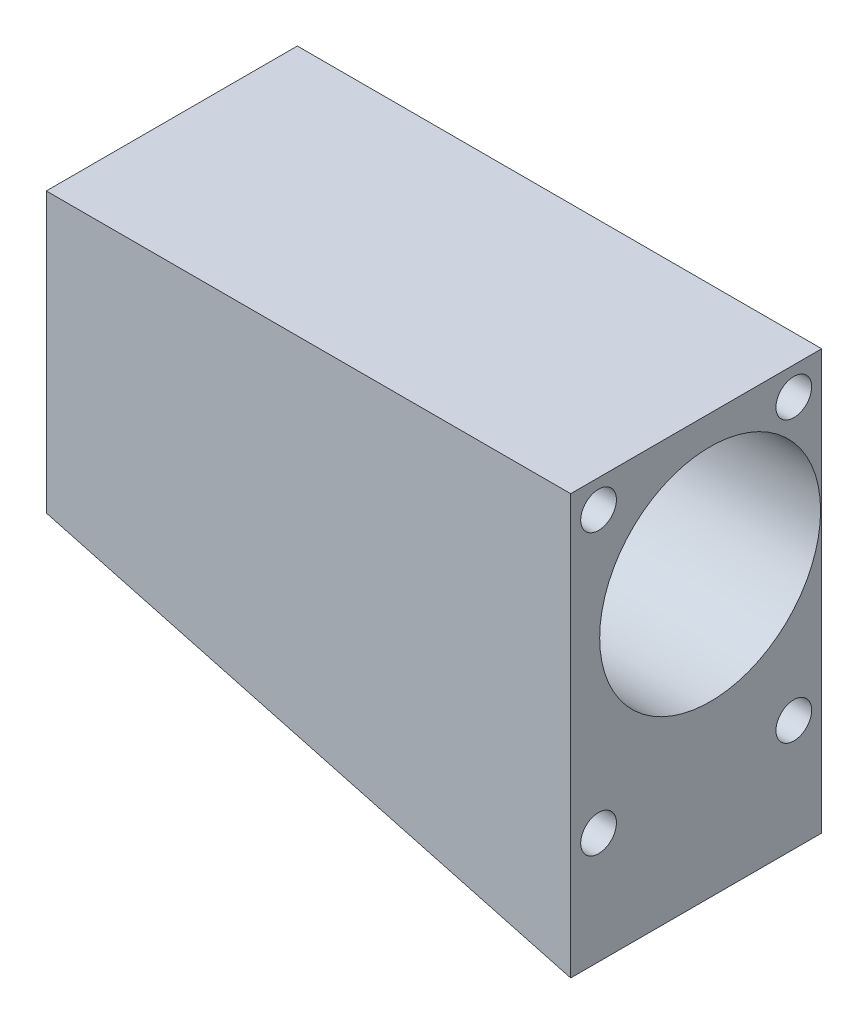
from build123d import *

# Parameters (mm, degrees)
SKETCH1_W           = 57.15
SKETCH1_H           = 31.75
BOSS_EXTRUDE1_DEPTH = 28.575
SKETCH2_R           = 12.573
CUT_EXTRUDE1_DEPTH  = 72.349251047
SKETCH3_W           = 2.54
SKETCH3_H           = 28.575
BOSS_EXTRUDE2_DEPTH = 31.75
SKETCH4_R           = 9.525
CUT_EXTRUDE2_DEPTH  = 2.54
BOSS_EXTRUDE3_DEPTH = 28.575
SKETCH6_R           = 2.032
CUT_EXTRUDE3_DEPTH  = 12.7


with BuildPart() as part:
    # Sketch1 → Boss-Extrude1 (new body)
    with BuildSketch(Plane.XY):
        with Locations((28.575, 15.875)):
            Rectangle(SKETCH1_W, SKETCH1_H)
    extrude(amount=-BOSS_EXTRUDE1_DEPTH)

    # Sketch2 → Cut-Extrude1 (cut, through all)
    with BuildSketch(Plane.ZY):
        with Locations((-15.875, 15.875)):
            Circle(SKETCH2_R)
    extrude(amount=-CUT_EXTRUDE1_DEPTH, mode=Mode.SUBTRACT)

    # Sketch3 → Boss-Extrude2 (add)
    with BuildSketch(Plane(origin=(0, 31.75, 0), x_dir=(1, 0, 0), z_dir=(0, 1, 0))):
        with Locations((-1.27, 14.2875)):
            Rectangle(SKETCH3_W, SKETCH3_H)
    extrude(amount=-BOSS_EXTRUDE2_DEPTH)

    # Sketch4 → Cut-Extrude2 (cut)
    with BuildSketch(Plane.ZY.offset(2.54)):
        with Locations((-15.875, 15.875)):
            Circle(SKETCH4_R)
    extrude(amount=-CUT_EXTRUDE2_DEPTH, mode=Mode.SUBTRACT)

    # Sketch5 → Boss-Extrude3 (add)
    with BuildSketch(Plane.XY):
        Polygon((-2.54, 0), (57.15, 0), (57.15, -15.993887296), align=None)
    extrude(amount=-BOSS_EXTRUDE3_DEPTH)

    # Sketch6 → Cut-Extrude3 (cut)
    with BuildSketch(Plane(origin=(57.15, 0, 0), x_dir=(0, 0, -1), z_dir=(1, 0, 0))):
        with Locations((3.175, 28.575)):
            Circle(SKETCH6_R)
        with Locations((25.4, 28.575)):
            Circle(SKETCH6_R)
        with Locations((25.4, -3.293887296)):
            Circle(SKETCH6_R)
        with Locations((3.175, -3.293887296)):
            Circle(SKETCH6_R)
    extrude(amount=-CUT_EXTRUDE3_DEPTH, mode=Mode.SUBTRACT)


solid = part.part
